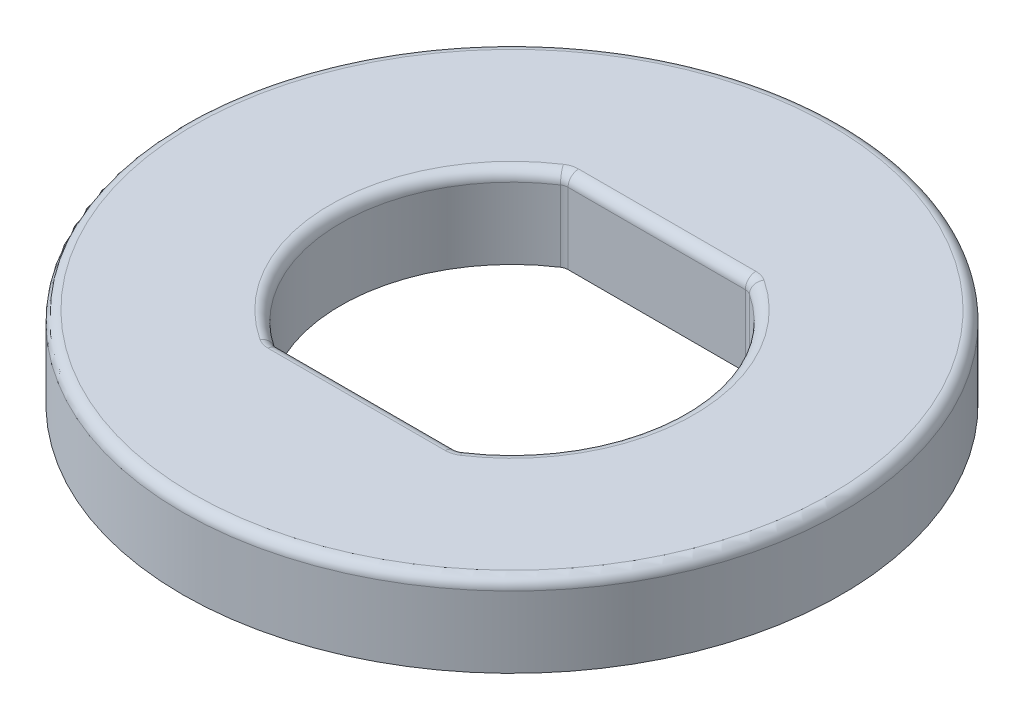
from build123d import *

# Parameters (mm, degrees)
SKETCH1_R           = 11.8618
BOSS_EXTRUDE1_DEPTH = 1.4732
FILLET1_R           = 0.381


with BuildPart() as part:
    # Sketch1 → Boss-Extrude1 (new, symmetric)
    with BuildSketch(Plane(origin=(0, 0, 0), x_dir=(1, 0, 0), z_dir=(0, 1, 0))):
        with Locations(Location((0, 0, 0), (0, 0, 270))):
            Circle(SKETCH1_R)
        with BuildLine():
            Line((3.302250327, 5.207), (-3.302250327, 5.207))
            ThreePointArc((-3.302250327, 5.207), (-6.16585, 0), (-3.302250327, -5.207))
            Line((-3.302250327, -5.207), (3.302250327, -5.207))
            ThreePointArc((3.302250327, -5.207), (6.16585, 0), (3.302250327, 5.207))
        make_face(mode=Mode.SUBTRACT)
    extrude(amount=BOSS_EXTRUDE1_DEPTH, both=True)

    # Fillet1
    fillet1_edges = [part.edges().sort_by_distance(p)[0] for p in [
        (3.302250327, 0, -5.207),
        (-3.302250327, 0, -5.207),
        (-3.302250327, 0, 5.207),
        (3.302250327, 0, 5.207),
        (0, 1.4732, 5.207),
        (-6.16585, 1.4732, 0),
        (0, 1.4732, -5.207),
        (0, 1.4732, -11.8618),
        (6.16585, 1.4732, 0),
    ]]
    fillet(fillet1_edges, radius=FILLET1_R)


solid = part.part
